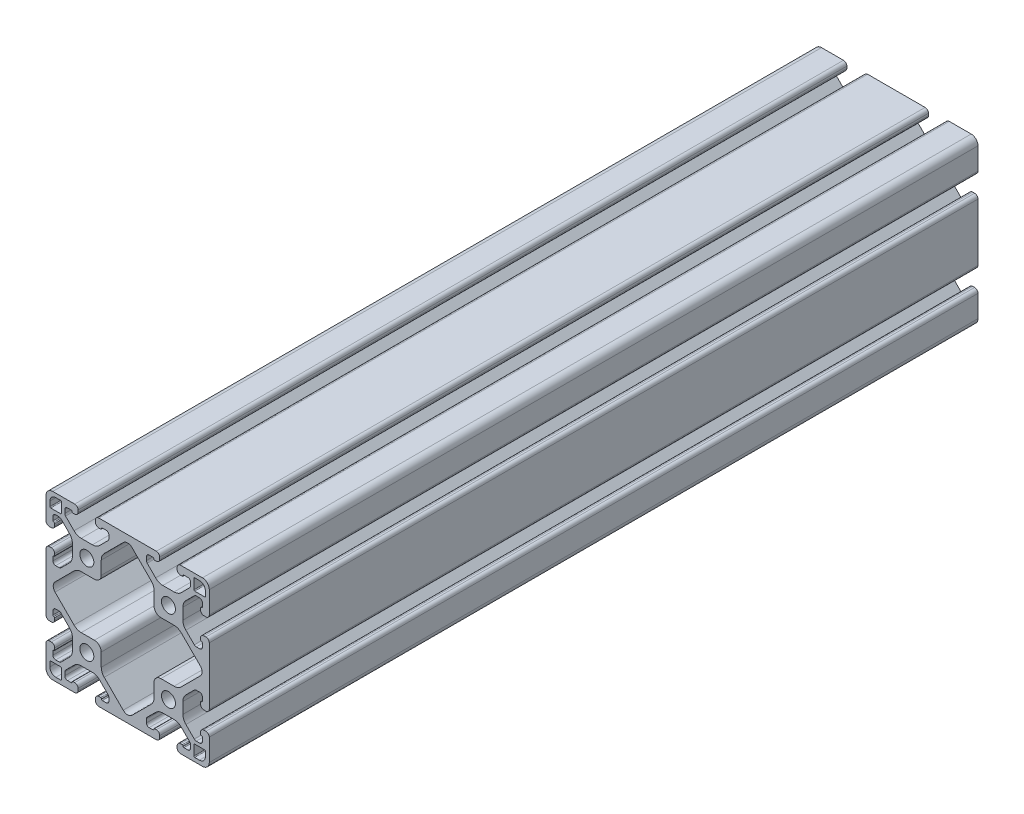
from build123d import *

# Parameters (mm, degrees)
SKETCH1_R           = 3.26771
BOSS_EXTRUDE1_DEPTH = 179.3875


with BuildPart() as part:
    # Sketch1 → Boss-Extrude1 (new, symmetric)
    with BuildSketch(Plane.XY):
        with BuildLine():
            Line((34.416992634, -25.907993142), (34.493192786, -25.907993142))
            ThreePointArc((34.493192786, -25.907993142), (34.762601009, -26.019585682), (34.874193548, -26.288993904))
            Line((34.874193548, -26.288993904), (34.874193548, -28.067))
            ThreePointArc((34.874193548, -28.067), (34.502225612, -28.965025612), (33.6042, -29.337))
            Line((33.6042, -29.337), (32.018312693, -29.337))
            ThreePointArc((32.018312693, -29.337), (31.532304734, -29.240327006), (31.120287081, -28.965025612))
            Line((31.120287081, -28.965025612), (27.172184211, -25.016922742))
            ThreePointArc((27.172184211, -25.016922742), (26.142556996, -23.475976719), (25.781, -21.658306952))
            Line((25.781, -21.658306952), (25.781, -16.441693048))
            ThreePointArc((25.781, -16.441693048), (26.142556996, -14.624023281), (27.172184211, -13.083077258))
            Line((27.172184211, -13.083077258), (31.120287081, -9.134974388))
            ThreePointArc((31.120287081, -9.134974388), (31.532304734, -8.859672994), (32.018312693, -8.763))
            Line((32.018312693, -8.763), (33.6042, -8.763))
            ThreePointArc((33.6042, -8.763), (34.50222105, -9.13497895), (34.874193548, -10.033))
            Line((34.874193548, -10.033), (34.874193548, -11.811006096))
            ThreePointArc((34.874193548, -11.811006096), (34.762601009, -12.080414319), (34.493192786, -12.192006858))
            Line((34.493192786, -12.192006858), (34.416992634, -12.192006858))
            ThreePointArc((34.416992634, -12.192006858), (34.147583105, -12.303600704), (34.035991872, -12.573011315))
            Line((34.035991872, -12.573011315), (34.036, -13.411215271))
            ThreePointArc((34.036, -13.411215271), (34.49725364, -14.524757158), (35.6108, -14.986))
            Line((35.6108, -14.986), (36.5252, -14.986))
            ThreePointArc((36.5252, -14.986), (37.638751759, -14.524751759), (38.1, -13.4112))
            Line((38.1, -13.4112), (38.1, 13.4112))
            ThreePointArc((38.1, 13.4112), (37.638751759, 14.524751759), (36.5252, 14.986))
            Line((36.5252, 14.986), (35.6108, 14.986))
            ThreePointArc((35.6108, 14.986), (34.49725364, 14.524757158), (34.036, 13.411215271))
            Line((34.036, 13.411215271), (34.035991872, 12.573011315))
            ThreePointArc((34.035991872, 12.573011315), (34.147583105, 12.303600704), (34.416992634, 12.192006858))
            Line((34.416992634, 12.192006858), (34.493192786, 12.192006858))
            ThreePointArc((34.493192786, 12.192006858), (34.762601009, 12.080414318), (34.874193548, 11.811006096))
            Line((34.874193548, 11.811006096), (34.874193548, 10.033))
            ThreePointArc((34.874193548, 10.033), (34.502225612, 9.134974388), (33.6042, 8.763))
            Line((33.6042, 8.763), (32.018312693, 8.763))
            ThreePointArc((32.018312693, 8.763), (31.532304734, 8.859672994), (31.120287081, 9.134974388))
            Line((31.120287081, 9.134974388), (27.172184211, 13.083077258))
            ThreePointArc((27.172184211, 13.083077258), (26.142556996, 14.624023281), (25.781, 16.441693048))
            Line((25.781, 16.441693048), (25.781, 21.658306952))
            ThreePointArc((25.781, 21.658306952), (26.142556996, 23.475976719), (27.172184211, 25.016922742))
            Line((27.172184211, 25.016922742), (31.120287081, 28.965025612))
            ThreePointArc((31.120287081, 28.965025612), (31.532304734, 29.240327006), (32.018312693, 29.337))
            Line((32.018312693, 29.337), (33.6042, 29.337))
            ThreePointArc((33.6042, 29.337), (34.50222105, 28.96502105), (34.874193548, 28.067))
            Line((34.874193548, 28.067), (34.874193548, 26.288993904))
            ThreePointArc((34.874193548, 26.288993904), (34.762601009, 26.019585681), (34.493192786, 25.907993142))
            Line((34.493192786, 25.907993142), (34.416992634, 25.907993142))
            ThreePointArc((34.416992634, 25.907993142), (34.147583105, 25.796399296), (34.035991872, 25.526988685))
            Line((34.035991872, 25.526988685), (34.036, 24.688784729))
            ThreePointArc((34.036, 24.688784729), (34.49725364, 23.575242842), (35.6108, 23.114))
            Line((35.6108, 23.114), (36.5252, 23.114))
            ThreePointArc((36.5252, 23.114), (37.638751759, 23.575248241), (38.1, 24.6888))
            Line((38.1, 24.6888), (38.1, 34.925))
            ThreePointArc((38.1, 34.925), (37.17006403, 37.17006403), (34.925, 38.1))
            Line((34.925, 38.1), (24.6888, 38.1))
            ThreePointArc((24.6888, 38.1), (23.575248241, 37.638751759), (23.114, 36.5252))
            Line((23.114, 36.5252), (23.114, 35.6108))
            ThreePointArc((23.114, 35.6108), (23.575242842, 34.49725364), (24.688784729, 34.036))
            Line((24.688784729, 34.036), (25.526988685, 34.035991872))
            ThreePointArc((25.526988685, 34.035991872), (25.796399296, 34.147583105), (25.907993142, 34.416992634))
            Line((25.907993142, 34.416992634), (25.907993142, 34.493192786))
            ThreePointArc((25.907993142, 34.493192786), (26.019585681, 34.762601009), (26.288993904, 34.874193548))
            Line((26.288993904, 34.874193548), (28.067, 34.874193548))
            ThreePointArc((28.067, 34.874193548), (28.965025612, 34.502225612), (29.337, 33.6042))
            Line((29.337, 33.6042), (29.337, 32.018312693))
            ThreePointArc((29.337, 32.018312693), (29.240327006, 31.532304734), (28.965025612, 31.120287081))
            Line((28.965025612, 31.120287081), (25.016922742, 27.172184211))
            ThreePointArc((25.016922742, 27.172184211), (23.475976719, 26.142556996), (21.658306952, 25.781))
            Line((21.658306952, 25.781), (16.441693048, 25.781))
            ThreePointArc((16.441693048, 25.781), (14.62402328, 26.142556996), (13.083077258, 27.172184211))
            Line((13.083077258, 27.172184211), (9.134974388, 31.120287081))
            ThreePointArc((9.134974388, 31.120287081), (8.859672994, 31.532304734), (8.763, 32.018312693))
            Line((8.763, 32.018312693), (8.763, 33.6042))
            ThreePointArc((8.763, 33.6042), (9.13497895, 34.50222105), (10.033, 34.874193548))
            Line((10.033, 34.874193548), (11.811006096, 34.874193548))
            ThreePointArc((11.811006096, 34.874193548), (12.080414318, 34.762601009), (12.192006858, 34.493192786))
            Line((12.192006858, 34.493192786), (12.192006858, 34.416992634))
            ThreePointArc((12.192006858, 34.416992634), (12.303600704, 34.147583105), (12.573011315, 34.035991872))
            Line((12.573011315, 34.035991872), (13.411215271, 34.036))
            ThreePointArc((13.411215271, 34.036), (14.524757158, 34.49725364), (14.986, 35.6108))
            Line((14.986, 35.6108), (14.986, 36.5252))
            ThreePointArc((14.986, 36.5252), (14.524751759, 37.638751759), (13.4112, 38.1))
            Line((13.4112, 38.1), (-13.4112, 38.1))
            ThreePointArc((-13.4112, 38.1), (-14.524751759, 37.638751759), (-14.986, 36.5252))
            Line((-14.986, 36.5252), (-14.986, 35.6108))
            ThreePointArc((-14.986, 35.6108), (-14.524757158, 34.49725364), (-13.411215271, 34.036))
            Line((-13.411215271, 34.036), (-12.573011315, 34.035991872))
            ThreePointArc((-12.573011315, 34.035991872), (-12.303600704, 34.147583105), (-12.192006858, 34.416992634))
            Line((-12.192006858, 34.416992634), (-12.192006858, 34.493192786))
            ThreePointArc((-12.192006858, 34.493192786), (-12.080414319, 34.762601009), (-11.811006096, 34.874193548))
            Line((-11.811006096, 34.874193548), (-10.033, 34.874193548))
            ThreePointArc((-10.033, 34.874193548), (-9.134974388, 34.502225612), (-8.763, 33.6042))
            Line((-8.763, 33.6042), (-8.763, 32.018312693))
            ThreePointArc((-8.763, 32.018312693), (-8.859672994, 31.532304734), (-9.134974388, 31.120287081))
            Line((-9.134974388, 31.120287081), (-13.083077258, 27.172184211))
            ThreePointArc((-13.083077258, 27.172184211), (-14.624023281, 26.142556996), (-16.441693048, 25.781))
            Line((-16.441693048, 25.781), (-21.658306952, 25.781))
            ThreePointArc((-21.658306952, 25.781), (-23.475976719, 26.142556996), (-25.016922742, 27.172184211))
            Line((-25.016922742, 27.172184211), (-28.965025612, 31.120287081))
            ThreePointArc((-28.965025612, 31.120287081), (-29.240327006, 31.532304734), (-29.337, 32.018312693))
            Line((-29.337, 32.018312693), (-29.337, 33.6042))
            ThreePointArc((-29.337, 33.6042), (-28.96502105, 34.50222105), (-28.067, 34.874193548))
            Line((-28.067, 34.874193548), (-26.288993904, 34.874193548))
            ThreePointArc((-26.288993904, 34.874193548), (-26.019585682, 34.762601009), (-25.907993142, 34.493192786))
            Line((-25.907993142, 34.493192786), (-25.907993142, 34.416992634))
            ThreePointArc((-25.907993142, 34.416992634), (-25.796399296, 34.147583105), (-25.526988685, 34.035991872))
            Line((-25.526988685, 34.035991872), (-24.688784729, 34.036))
            ThreePointArc((-24.688784729, 34.036), (-23.575242842, 34.49725364), (-23.114, 35.6108))
            Line((-23.114, 35.6108), (-23.114, 36.5252))
            ThreePointArc((-23.114, 36.5252), (-23.575248241, 37.638751759), (-24.6888, 38.1))
            Line((-24.6888, 38.1), (-34.925, 38.1))
            ThreePointArc((-34.925, 38.1), (-37.17006403, 37.17006403), (-38.1, 34.925))
            Line((-38.1, 34.925), (-38.1, 24.6888))
            ThreePointArc((-38.1, 24.6888), (-37.638751759, 23.575248241), (-36.5252, 23.114))
            Line((-36.5252, 23.114), (-35.6108, 23.114))
            ThreePointArc((-35.6108, 23.114), (-34.49725364, 23.575242842), (-34.036, 24.688784729))
            Line((-34.036, 24.688784729), (-34.035991872, 25.526988685))
            ThreePointArc((-34.035991872, 25.526988685), (-34.147583105, 25.796399296), (-34.416992634, 25.907993142))
            Line((-34.416992634, 25.907993142), (-34.493192786, 25.907993142))
            ThreePointArc((-34.493192786, 25.907993142), (-34.762601009, 26.019585681), (-34.874193548, 26.288993904))
            Line((-34.874193548, 26.288993904), (-34.874193548, 28.067))
            ThreePointArc((-34.874193548, 28.067), (-34.502225612, 28.965025612), (-33.6042, 29.337))
            Line((-33.6042, 29.337), (-32.018312693, 29.337))
            ThreePointArc((-32.018312693, 29.337), (-31.532304734, 29.240327006), (-31.120287081, 28.965025612))
            Line((-31.120287081, 28.965025612), (-27.172184211, 25.016922742))
            ThreePointArc((-27.172184211, 25.016922742), (-26.142556996, 23.475976719), (-25.781, 21.658306952))
            Line((-25.781, 21.658306952), (-25.781, 16.441693048))
            ThreePointArc((-25.781, 16.441693048), (-26.142556996, 14.624023281), (-27.172184211, 13.083077258))
            Line((-27.172184211, 13.083077258), (-31.120287081, 9.134974388))
            ThreePointArc((-31.120287081, 9.134974388), (-31.532304734, 8.859672994), (-32.018312693, 8.763))
            Line((-32.018312693, 8.763), (-33.6042, 8.763))
            ThreePointArc((-33.6042, 8.763), (-34.50222105, 9.13497895), (-34.874193548, 10.033))
            Line((-34.874193548, 10.033), (-34.874193548, 11.811006096))
            ThreePointArc((-34.874193548, 11.811006096), (-34.762601009, 12.080414318), (-34.493192786, 12.192006858))
            Line((-34.493192786, 12.192006858), (-34.416992634, 12.192006858))
            ThreePointArc((-34.416992634, 12.192006858), (-34.147583105, 12.303600704), (-34.035991872, 12.573011315))
            Line((-34.035991872, 12.573011315), (-34.036, 13.411215271))
            ThreePointArc((-34.036, 13.411215271), (-34.49725364, 14.524757158), (-35.6108, 14.986))
            Line((-35.6108, 14.986), (-36.5252, 14.986))
            ThreePointArc((-36.5252, 14.986), (-37.638751759, 14.524751759), (-38.1, 13.4112))
            Line((-38.1, 13.4112), (-38.1, -13.4112))
            ThreePointArc((-38.1, -13.4112), (-37.638751759, -14.524751759), (-36.5252, -14.986))
            Line((-36.5252, -14.986), (-35.6108, -14.986))
            ThreePointArc((-35.6108, -14.986), (-34.49725364, -14.524757158), (-34.036, -13.411215271))
            Line((-34.036, -13.411215271), (-34.035991872, -12.573011315))
            ThreePointArc((-34.035991872, -12.573011315), (-34.147583105, -12.303600704), (-34.416992634, -12.192006858))
            Line((-34.416992634, -12.192006858), (-34.493192786, -12.192006858))
            ThreePointArc((-34.493192786, -12.192006858), (-34.762601009, -12.080414319), (-34.874193548, -11.811006096))
            Line((-34.874193548, -11.811006096), (-34.874193548, -10.033))
            ThreePointArc((-34.874193548, -10.033), (-34.502225612, -9.134974388), (-33.6042, -8.763))
            Line((-33.6042, -8.763), (-32.018312693, -8.763))
            ThreePointArc((-32.018312693, -8.763), (-31.532304734, -8.859672994), (-31.120287081, -9.134974388))
            Line((-31.120287081, -9.134974388), (-27.172184211, -13.083077258))
            ThreePointArc((-27.172184211, -13.083077258), (-26.142556996, -14.624023281), (-25.781, -16.441693048))
            Line((-25.781, -16.441693048), (-25.781, -21.658306952))
            ThreePointArc((-25.781, -21.658306952), (-26.142556996, -23.475976719), (-27.172184211, -25.016922742))
            Line((-27.172184211, -25.016922742), (-31.120287081, -28.965025612))
            ThreePointArc((-31.120287081, -28.965025612), (-31.532304734, -29.240327006), (-32.018312693, -29.337))
            Line((-32.018312693, -29.337), (-33.6042, -29.337))
            ThreePointArc((-33.6042, -29.337), (-34.50222105, -28.96502105), (-34.874193548, -28.067))
            Line((-34.874193548, -28.067), (-34.874193548, -26.288993904))
            ThreePointArc((-34.874193548, -26.288993904), (-34.762601009, -26.019585682), (-34.493192786, -25.907993142))
            Line((-34.493192786, -25.907993142), (-34.416992634, -25.907993142))
            ThreePointArc((-34.416992634, -25.907993142), (-34.147583105, -25.796399296), (-34.035991872, -25.526988685))
            Line((-34.035991872, -25.526988685), (-34.036, -24.688784729))
            ThreePointArc((-34.036, -24.688784729), (-34.49725364, -23.575242842), (-35.6108, -23.114))
            Line((-35.6108, -23.114), (-36.5252, -23.114))
            ThreePointArc((-36.5252, -23.114), (-37.638751759, -23.575248241), (-38.1, -24.6888))
            Line((-38.1, -24.6888), (-38.1, -34.925))
            ThreePointArc((-38.1, -34.925), (-37.17006403, -37.17006403), (-34.925, -38.1))
            Line((-34.925, -38.1), (-24.6888, -38.1))
            ThreePointArc((-24.6888, -38.1), (-23.575248241, -37.638751759), (-23.114, -36.5252))
            Line((-23.114, -36.5252), (-23.114, -35.6108))
            ThreePointArc((-23.114, -35.6108), (-23.575242842, -34.49725364), (-24.688784729, -34.036))
            Line((-24.688784729, -34.036), (-25.526988685, -34.035991872))
            ThreePointArc((-25.526988685, -34.035991872), (-25.796399296, -34.147583105), (-25.907993142, -34.416992634))
            Line((-25.907993142, -34.416992634), (-25.907993142, -34.493192786))
            ThreePointArc((-25.907993142, -34.493192786), (-26.019585682, -34.762601009), (-26.288993904, -34.874193548))
            Line((-26.288993904, -34.874193548), (-28.067, -34.874193548))
            ThreePointArc((-28.067, -34.874193548), (-28.965025612, -34.502225612), (-29.337, -33.6042))
            Line((-29.337, -33.6042), (-29.337, -32.018312693))
            ThreePointArc((-29.337, -32.018312693), (-29.240327006, -31.532304734), (-28.965025612, -31.120287081))
            Line((-28.965025612, -31.120287081), (-25.016922742, -27.172184211))
            ThreePointArc((-25.016922742, -27.172184211), (-23.475976719, -26.142556997), (-21.658306952, -25.781))
            Line((-21.658306952, -25.781), (-16.441693048, -25.781))
            ThreePointArc((-16.441693048, -25.781), (-14.624023281, -26.142556997), (-13.083077258, -27.172184211))
            Line((-13.083077258, -27.172184211), (-9.134974388, -31.120287081))
            ThreePointArc((-9.134974388, -31.120287081), (-8.859672994, -31.532304734), (-8.763, -32.018312693))
            Line((-8.763, -32.018312693), (-8.763, -33.6042))
            ThreePointArc((-8.763, -33.6042), (-9.13497895, -34.50222105), (-10.033, -34.874193548))
            Line((-10.033, -34.874193548), (-11.811006096, -34.874193548))
            ThreePointArc((-11.811006096, -34.874193548), (-12.080414319, -34.762601009), (-12.192006858, -34.493192786))
            Line((-12.192006858, -34.493192786), (-12.192006858, -34.416992634))
            ThreePointArc((-12.192006858, -34.416992634), (-12.303600704, -34.147583105), (-12.573011315, -34.035991872))
            Line((-12.573011315, -34.035991872), (-13.411215271, -34.036))
            ThreePointArc((-13.411215271, -34.036), (-14.524757158, -34.49725364), (-14.986, -35.6108))
            Line((-14.986, -35.6108), (-14.986, -36.5252))
            ThreePointArc((-14.986, -36.5252), (-14.524751759, -37.638751759), (-13.4112, -38.1))
            Line((-13.4112, -38.1), (13.4112, -38.1))
            ThreePointArc((13.4112, -38.1), (14.524751759, -37.638751759), (14.986, -36.5252))
            Line((14.986, -36.5252), (14.986, -35.6108))
            ThreePointArc((14.986, -35.6108), (14.524757158, -34.49725364), (13.411215271, -34.036))
            Line((13.411215271, -34.036), (12.573011315, -34.035991872))
            ThreePointArc((12.573011315, -34.035991872), (12.303600704, -34.147583105), (12.192006858, -34.416992634))
            Line((12.192006858, -34.416992634), (12.192006858, -34.493192786))
            ThreePointArc((12.192006858, -34.493192786), (12.080414318, -34.762601009), (11.811006096, -34.874193548))
            Line((11.811006096, -34.874193548), (10.033, -34.874193548))
            ThreePointArc((10.033, -34.874193548), (9.134974388, -34.502225612), (8.763, -33.6042))
            Line((8.763, -33.6042), (8.763, -32.018312693))
            ThreePointArc((8.763, -32.018312693), (8.859672994, -31.532304734), (9.134974388, -31.120287081))
            Line((9.134974388, -31.120287081), (13.083077258, -27.172184211))
            ThreePointArc((13.083077258, -27.172184211), (14.62402328, -26.142556997), (16.441693048, -25.781))
            Line((16.441693048, -25.781), (21.658306952, -25.781))
            ThreePointArc((21.658306952, -25.781), (23.475976719, -26.142556997), (25.016922742, -27.172184211))
            Line((25.016922742, -27.172184211), (28.965025612, -31.120287081))
            ThreePointArc((28.965025612, -31.120287081), (29.240327006, -31.532304734), (29.337, -32.018312693))
            Line((29.337, -32.018312693), (29.337, -33.6042))
            ThreePointArc((29.337, -33.6042), (28.96502105, -34.50222105), (28.067, -34.874193548))
            Line((28.067, -34.874193548), (26.288993904, -34.874193548))
            ThreePointArc((26.288993904, -34.874193548), (26.019585681, -34.762601009), (25.907993142, -34.493192786))
            Line((25.907993142, -34.493192786), (25.907993142, -34.416992634))
            ThreePointArc((25.907993142, -34.416992634), (25.796399296, -34.147583105), (25.526988685, -34.035991872))
            Line((25.526988685, -34.035991872), (24.688784729, -34.036))
            ThreePointArc((24.688784729, -34.036), (23.575242842, -34.49725364), (23.114, -35.6108))
            Line((23.114, -35.6108), (23.114, -36.5252))
            ThreePointArc((23.114, -36.5252), (23.575248241, -37.638751759), (24.6888, -38.1))
            Line((24.6888, -38.1), (34.925, -38.1))
            ThreePointArc((34.925, -38.1), (37.17006403, -37.17006403), (38.1, -34.925))
            Line((38.1, -34.925), (38.1, -24.6888))
            ThreePointArc((38.1, -24.6888), (37.638751759, -23.575248241), (36.5252, -23.114))
            Line((36.5252, -23.114), (35.6108, -23.114))
            ThreePointArc((35.6108, -23.114), (34.49725364, -23.575242842), (34.036, -24.688784729))
            Line((34.036, -24.688784729), (34.035991872, -25.526988685))
            ThreePointArc((34.035991872, -25.526988685), (34.147583105, -25.796399296), (34.416992634, -25.907993142))
        make_face()
        with Locations((-19.05, 19.05)):
            Circle(SKETCH1_R, mode=Mode.SUBTRACT)
        with Locations((19.05, 19.05)):
            Circle(SKETCH1_R, mode=Mode.SUBTRACT)
        with Locations((19.05, -19.05)):
            Circle(SKETCH1_R, mode=Mode.SUBTRACT)
        with Locations((-19.05, -19.05)):
            Circle(SKETCH1_R, mode=Mode.SUBTRACT)
        with BuildLine():
            Line((33.879279623, 2.065458943), (25.016922742, 10.927815824))
            ThreePointArc((25.016922742, 10.927815824), (23.475976719, 11.957443039), (21.658306952, 12.319000035))
            Line((21.658306952, 12.319000035), (15.494, 12.319000035))
            ThreePointArc((15.494, 12.319000035), (13.24893597, 13.248936005), (12.319, 15.494000035))
            Line((12.319, 15.494000035), (12.319, 21.658306987))
            ThreePointArc((12.319, 21.658306987), (11.957443004, 23.475976754), (10.927815789, 25.016922777))
            Line((10.927815789, 25.016922777), (2.065458925, 33.879279641))
            ThreePointArc((2.065458925, 33.879279641), (1.8e-08, 34.734820733), (-2.06545889, 33.879279641))
            Line((-2.06545889, 33.879279641), (-10.927815789, 25.016922742))
            ThreePointArc((-10.927815789, 25.016922742), (-11.957443004, 23.475976719), (-12.319, 21.658306952))
            Line((-12.319, 21.658306952), (-12.319, 15.494))
            ThreePointArc((-12.319, 15.494), (-13.24893597, 13.24893597), (-15.494, 12.319))
            Line((-15.494, 12.319), (-21.658306952, 12.319))
            ThreePointArc((-21.658306952, 12.319), (-23.475976719, 11.957443004), (-25.016922742, 10.927815789))
            Line((-25.016922742, 10.927815789), (-33.879279623, 2.065458908))
            ThreePointArc((-33.879279623, 2.065458908), (-34.734820715, 0), (-33.879279623, -2.065458908))
            Line((-33.879279623, -2.065458908), (-25.016922742, -10.927815789))
            ThreePointArc((-25.016922742, -10.927815789), (-23.475976719, -11.957443004), (-21.658306952, -12.319))
            Line((-21.658306952, -12.319), (-15.494, -12.319))
            ThreePointArc((-15.494, -12.319), (-13.24893597, -13.24893597), (-12.319, -15.494))
            Line((-12.319, -15.494), (-12.319, -21.658306952))
            ThreePointArc((-12.319, -21.658306952), (-11.957443004, -23.475976719), (-10.927815789, -25.016922742))
            Line((-10.927815789, -25.016922742), (-2.065458925, -33.879279606))
            ThreePointArc((-2.065458925, -33.879279606), (-1.8e-08, -34.734820698), (2.06545889, -33.879279606))
            Line((2.06545889, -33.879279606), (10.927815789, -25.016922707))
            ThreePointArc((10.927815789, -25.016922707), (11.957443004, -23.475976684), (12.319, -21.658306917))
            Line((12.319, -21.658306917), (12.319, -15.493999965))
            ThreePointArc((12.319, -15.493999965), (13.24893597, -13.248935935), (15.494, -12.318999965))
            Line((15.494, -12.318999965), (21.658306952, -12.318999965))
            ThreePointArc((21.658306952, -12.318999965), (23.475976719, -11.957442969), (25.016922742, -10.927815754))
            Line((25.016922742, -10.927815754), (33.879279623, -2.065458873))
            ThreePointArc((33.879279623, -2.065458873), (34.734820715, 3.5e-08), (33.879279623, 2.065458943))
        make_face(mode=Mode.SUBTRACT)
        with BuildLine():
            Line((-31.2928, 36.2966), (-33.5026, 36.2966))
            ThreePointArc((-33.5026, 36.2966), (-35.478256347, 35.478256347), (-36.2966, 33.5026))
            Line((-36.2966, 33.5026), (-36.2966, 31.2928))
            ThreePointArc((-36.2966, 31.2928), (-36.185007684, 31.023392316), (-35.9156, 30.9118))
            Line((-35.9156, 30.9118), (-31.2928, 30.9118))
            ThreePointArc((-31.2928, 30.9118), (-31.023392316, 31.023392316), (-30.9118, 31.2928))
            Line((-30.9118, 31.2928), (-30.9118, 35.9156))
            ThreePointArc((-30.9118, 35.9156), (-31.023392316, 36.185007684), (-31.2928, 36.2966))
        make_face(mode=Mode.SUBTRACT)
        with BuildLine():
            Line((30.9118, 35.9156), (30.9118, 31.2928))
            ThreePointArc((30.9118, 31.2928), (31.023392316, 31.023392316), (31.2928, 30.9118))
            Line((31.2928, 30.9118), (35.9156, 30.9118))
            ThreePointArc((35.9156, 30.9118), (36.185007684, 31.023392316), (36.2966, 31.2928))
            Line((36.2966, 31.2928), (36.2966, 33.5026))
            ThreePointArc((36.2966, 33.5026), (35.478256347, 35.478256347), (33.5026, 36.2966))
            Line((33.5026, 36.2966), (31.2928, 36.2966))
            ThreePointArc((31.2928, 36.2966), (31.023392316, 36.185007684), (30.9118, 35.9156))
        make_face(mode=Mode.SUBTRACT)
        with BuildLine():
            Line((31.2928, -36.2966), (33.5026, -36.2966))
            ThreePointArc((33.5026, -36.2966), (35.478256347, -35.478256347), (36.2966, -33.5026))
            Line((36.2966, -33.5026), (36.2966, -31.2928))
            ThreePointArc((36.2966, -31.2928), (36.185007684, -31.023392316), (35.9156, -30.9118))
            Line((35.9156, -30.9118), (31.2928, -30.9118))
            ThreePointArc((31.2928, -30.9118), (31.023392316, -31.023392316), (30.9118, -31.2928))
            Line((30.9118, -31.2928), (30.9118, -35.9156))
            ThreePointArc((30.9118, -35.9156), (31.023392316, -36.185007684), (31.2928, -36.2966))
        make_face(mode=Mode.SUBTRACT)
        with BuildLine():
            Line((-30.9118, -35.9156), (-30.9118, -31.2928))
            ThreePointArc((-30.9118, -31.2928), (-31.023392316, -31.023392316), (-31.2928, -30.9118))
            Line((-31.2928, -30.9118), (-35.9156, -30.9118))
            ThreePointArc((-35.9156, -30.9118), (-36.185007684, -31.023392316), (-36.2966, -31.2928))
            Line((-36.2966, -31.2928), (-36.2966, -33.5026))
            ThreePointArc((-36.2966, -33.5026), (-35.478256347, -35.478256347), (-33.5026, -36.2966))
            Line((-33.5026, -36.2966), (-31.2928, -36.2966))
            ThreePointArc((-31.2928, -36.2966), (-31.023392316, -36.185007684), (-30.9118, -35.9156))
        make_face(mode=Mode.SUBTRACT)
    extrude(amount=BOSS_EXTRUDE1_DEPTH, both=True)


solid = part.part
